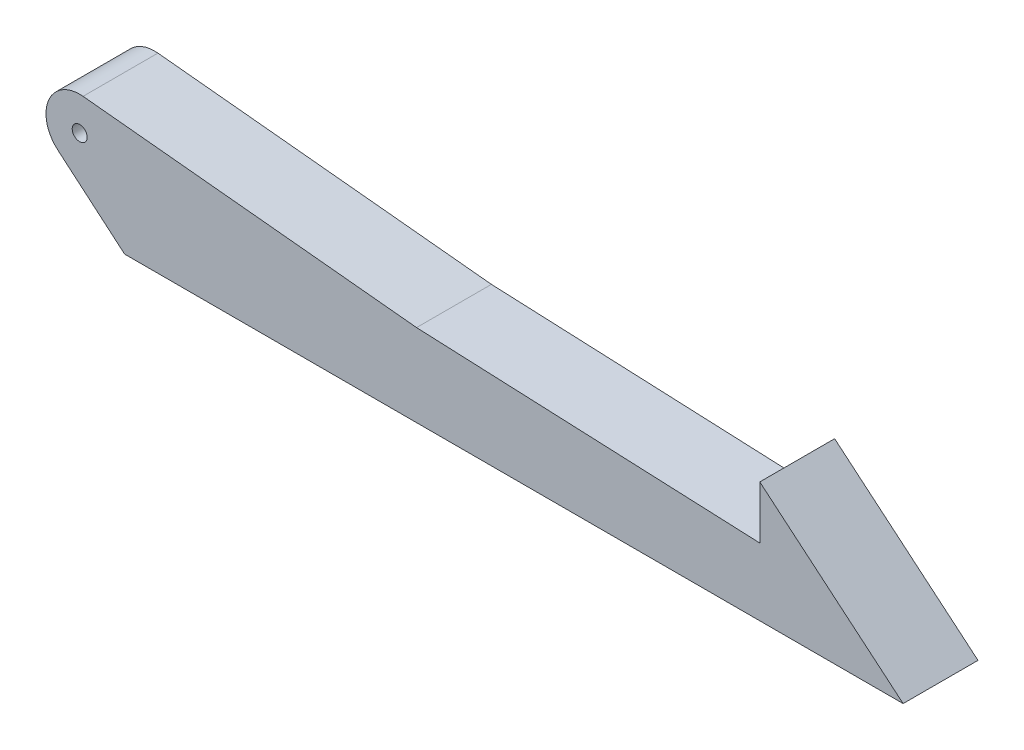
from build123d import *

# Parameters (mm, degrees)
SKETCH1_R           = 1
BOSS_EXTRUDE1_DEPTH = 10


with BuildPart() as part:
    # Sketch1 → Boss-Extrude1 (new body)
    with BuildSketch(Plane.XY):
        with BuildLine():
            Line((0.45, 4.477443467), (45, 0))
            Line((45, 0), (90.848888922, -2))
            Line((90.848888922, -2), (90.848888922, 5.069690242))
            Line((90.848888922, 5.069690242), (110, -11))
            Line((110, -11), (6, -11))
            Line((6, -11), (-2.91308134, -3.429862549))
            ThreePointArc((-2.91308134, -3.429862549), (-4.14102216, 1.761231237), (0.45, 4.477443467))
        make_face()
        Circle(SKETCH1_R, mode=Mode.SUBTRACT)
    extrude(amount=BOSS_EXTRUDE1_DEPTH)


solid = part.part
